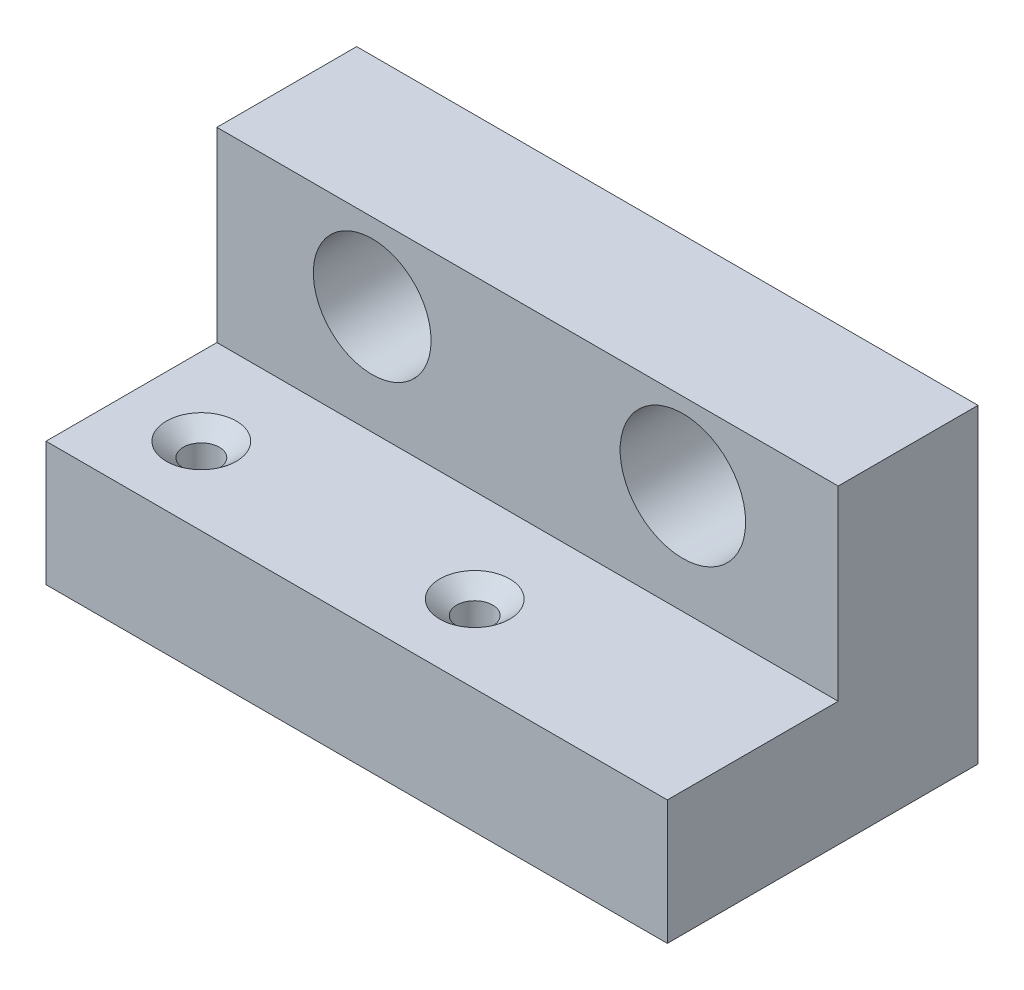
from build123d import *

# Parameters (mm, degrees)
SKETCH1_W                                         = 50.8
SKETCH1_H                                         = 25.4
SKETCH1_R                                         = 4.8133
SKETCH1_R_2                                       = 5.1308
BOSS_EXTRUDE1_DEPTH                               = 11.43
SKETCH2_W                                         = 50.8
SKETCH2_H                                         = 25.4
BOSS_EXTRUDE2_DEPTH                               = 10.16
CSK_FOR_4_FLAT_HEAD_MACHINE_SCREW_100_D           = 2.9464
CSK_FOR_4_FLAT_HEAD_MACHINE_SCREW_100_CSINK_D     = 5.715
CSK_FOR_4_FLAT_HEAD_MACHINE_SCREW_100_CSINK_ANGLE = 100


with BuildPart() as part:
    # Sketch1 → Boss-Extrude1 (new body)
    with BuildSketch(Plane.XY):
        with Locations((25.4, 12.7)):
            Rectangle(SKETCH1_W, SKETCH1_H)
        with Locations((12.7, 19.05)):
            Circle(SKETCH1_R, mode=Mode.SUBTRACT)
        with Locations((38.1, 19.05)):
            Circle(SKETCH1_R_2, mode=Mode.SUBTRACT)
    extrude(amount=BOSS_EXTRUDE1_DEPTH)

    # Sketch2 → Boss-Extrude2 (add)
    with BuildSketch(Plane(origin=(0, 0, 0), x_dir=(1, 0, 0), z_dir=(0, 1, 0))):
        with Locations((25.4, -12.7)):
            Rectangle(SKETCH2_W, SKETCH2_H)
    extrude(amount=BOSS_EXTRUDE2_DEPTH)

    # CSK for #4 Flat Head Machine Screw (100)1 (through all)
    with Locations(Plane(origin=(0, 10.16, 0), x_dir=(1, 0, 0), z_dir=(0, 1, 0))):
        with Locations((28.702, -19.05), (6.35, -19.05)):
            CounterSinkHole(CSK_FOR_4_FLAT_HEAD_MACHINE_SCREW_100_D / 2, CSK_FOR_4_FLAT_HEAD_MACHINE_SCREW_100_CSINK_D / 2, counter_sink_angle=CSK_FOR_4_FLAT_HEAD_MACHINE_SCREW_100_CSINK_ANGLE)


solid = part.part
